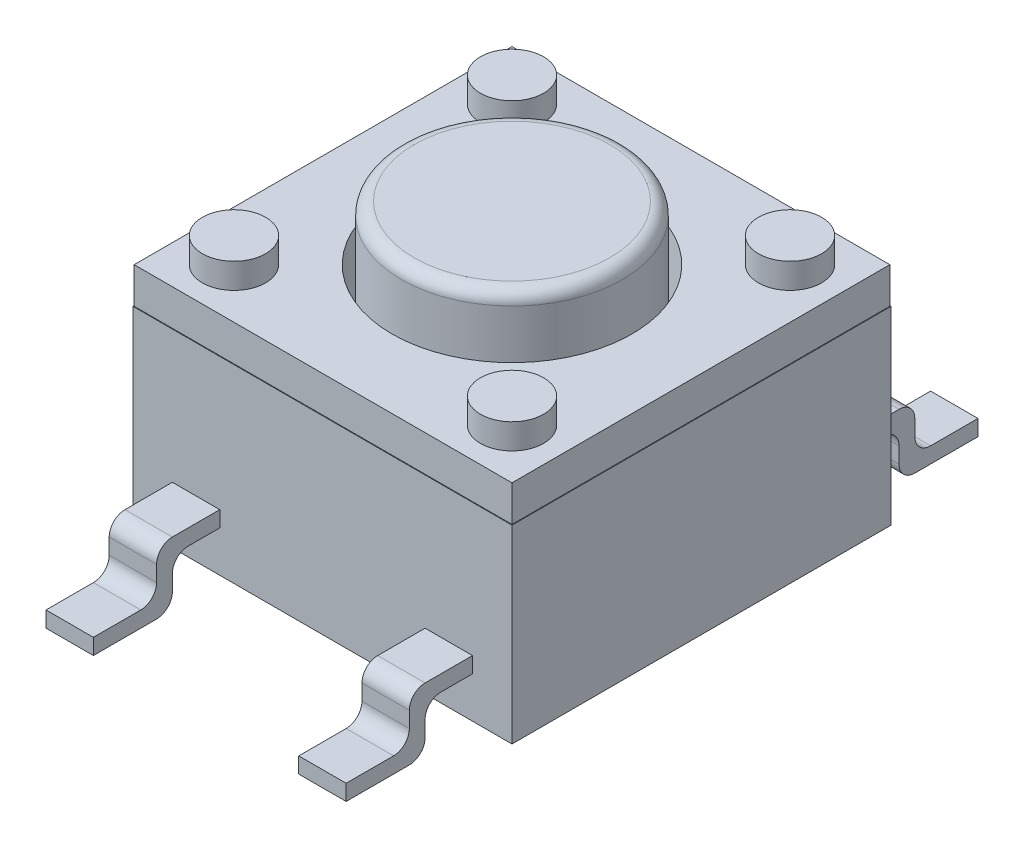
from build123d import *

# Parameters (mm, degrees)
SKETCH1_W            = 6
SKETCH1_H            = 6
SKETCH1_R            = 1.9
EXTRUDE1_DEPTH       = 3
SKETCH2_W            = 5.98
SKETCH2_H            = 5.98
SKETCH2_R            = 1.9
EXTRUDE2_DEPTH       = 0.57
SKETCH3_R            = 0.5
EXTRUDE3_DEPTH       = 0.4
EXTRUDE4_DEPTH       = 0.87
EXTRUDE4_DEPTH_BACK  = 3
SKETCH4_R            = 1.75
FILLET1_R            = 0.2
EXTRUDE5_DEPTH       = 0.375
FILLET2_R            = 0.25
FILLET2_OF_MIRROR1_R = 0.25


with BuildPart() as part:
    # Sketch1 → Extrude1 (new body)
    with BuildSketch(Plane(origin=(0, 0, 0), x_dir=(1, 0, 0), z_dir=(0, 1, 0))):
        Rectangle(SKETCH1_W, SKETCH1_H)
        with Locations(Location((0, 0, 0), (0, 0, 270))):
            Circle(SKETCH1_R, mode=Mode.SUBTRACT)
    extrude(amount=EXTRUDE1_DEPTH)

    # Sketch2 → Extrude2 (add)
    with BuildSketch(Plane(origin=(0, 3, 0), x_dir=(1, 0, 0), z_dir=(0, 1, 0))):
        Rectangle(SKETCH2_W, SKETCH2_H)
        with Locations(Location((0, 0, 0), (0, 0, 270))):
            Circle(SKETCH2_R, mode=Mode.SUBTRACT)
    extrude(amount=EXTRUDE2_DEPTH)

    # Sketch3 → Extrude3 (add)
    with BuildSketch(Plane(origin=(0, 3.57, 0), x_dir=(1, 0, 0), z_dir=(0, 1, 0))):
        with Locations(Location((-2.2, 2.2, 0), (0, 0, 270))):
            Circle(SKETCH3_R)
        with Locations(Location((2.2, 2.2, 0), (0, 0, 270))):
            Circle(SKETCH3_R)
        with Locations(Location((2.2, -2.2, 0), (0, 0, 270))):
            Circle(SKETCH3_R)
        with Locations(Location((-2.2, -2.2, 0), (0, 0, 270))):
            Circle(SKETCH3_R)
    extrude(amount=EXTRUDE3_DEPTH)

    # Sketch5 → Extrude5 (add, symmetric)
    with BuildSketch(Plane(origin=(2, 0, 0), x_dir=(0, 0, -1), z_dir=(1, 0, 0))):
        Polygon((-5, 0.15), (-4, 0.15), (-4, 0.9), (-3, 0.9), (-3, 0.65), (-3.75, 0.65), (-3.75, -0.1), (-5, -0.1), align=None)
        Polygon((5, 0.15), (5, -0.1), (3.75, -0.1), (3.75, 0.65), (3, 0.65), (3, 0.9), (4, 0.9), (4, 0.15), align=None)
    extrude5 = extrude(amount=EXTRUDE5_DEPTH, both=True)

    # Fillet2
    fillet2_edges = [part.edges().sort_by_distance(p)[0] for p in [
        (2, -0.1, 3.75),
        (2, 0.65, 3.75),
        (2, 0.9, 4),
        (2, 0.15, 4),
        (2, 0.15, -4),
        (2, 0.9, -4),
        (2, 0.65, -3.75),
        (2, -0.1, -3.75),
    ]]
    fillet(fillet2_edges, radius=FILLET2_R)

    # Mirror1: Extrude5 across plane
    add(extrude5.mirror(Plane(origin=(0, 0, 0), x_dir=(0, 0, 1), z_dir=(1, 0, 0))))

    # Fillet2 of Mirror1
    fillet2_of_mirror1_edges = [part.edges().sort_by_distance(p)[0] for p in [
        (-2, -0.1, 3.75),
        (-2, 0.65, 3.75),
        (-2, 0.9, 4),
        (-2, 0.15, 4),
        (-2, 0.15, -4),
        (-2, 0.9, -4),
        (-2, 0.65, -3.75),
        (-2, -0.1, -3.75),
    ]]
    fillet(fillet2_of_mirror1_edges, radius=FILLET2_OF_MIRROR1_R)


with BuildPart() as body_2:
    # Sketch4 → Extrude4 (new, two sides: drawn at the far end of the back side and taken through both)
    with BuildSketch(Plane(origin=(0, 3.57, 0), x_dir=(1, 0, 0), z_dir=(0, 1, 0)).offset(-EXTRUDE4_DEPTH_BACK)):
        with Locations(Location((0, 0, 0), (0, 0, 270))):
            Circle(SKETCH4_R)
    extrude(amount=EXTRUDE4_DEPTH + EXTRUDE4_DEPTH_BACK)

    # Fillet1
    fillet1_edges = [body_2.edges().sort_by_distance(p)[0] for p in [
        (0, 4.44, -1.75),
    ]]
    fillet(fillet1_edges, radius=FILLET1_R)


solid = Compound([part.part, body_2.part])
